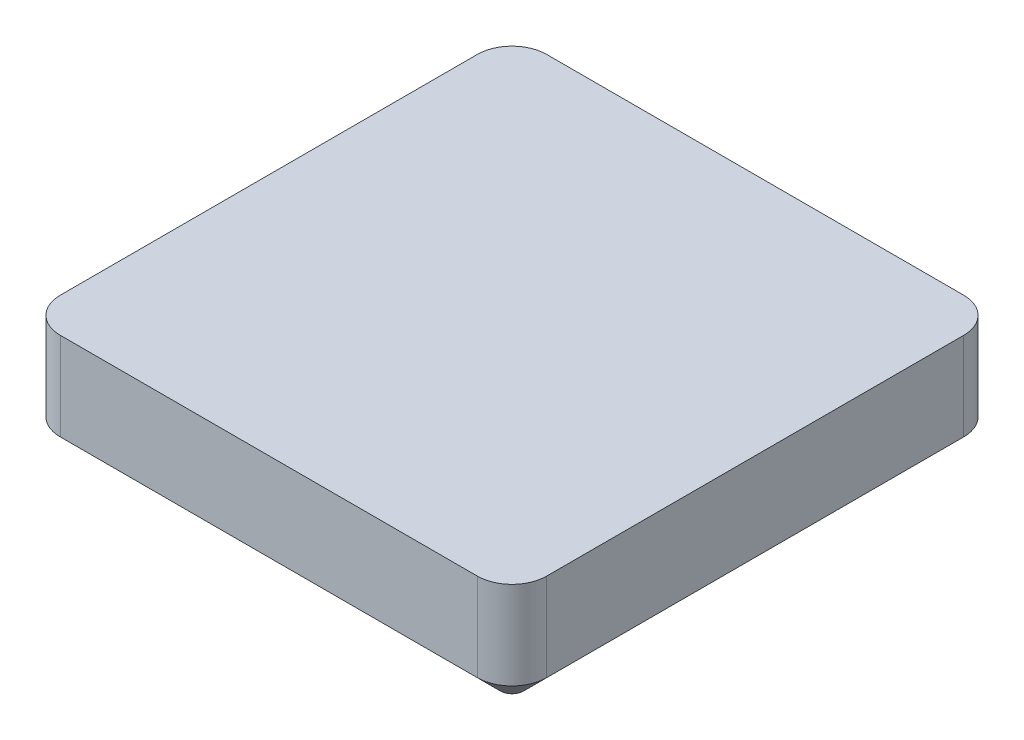
from build123d import *

# Parameters (mm, degrees)
SKETCH_1_W      = 210
SKETCH_1_H      = 210
EXTRUDE_1_DEPTH = 48
FILLET_1_R      = 15
CHAMFER_1_SIZE  = 10


with BuildPart() as part:
    # 草图1 → 凸台-拉伸1 (new body)
    with BuildSketch(Plane(origin=(0, 0, 0), x_dir=(1, 0, 0), z_dir=(0, 1, 0))):
        with Locations((105, -105)):
            Rectangle(SKETCH_1_W, SKETCH_1_H)
    extrude(amount=EXTRUDE_1_DEPTH)

    # 圆角1
    fillet_1_edges = [part.edges().sort_by_distance(p)[0] for p in [
        (0, 24, 0),
        (210, 24, 0),
        (210, 24, 210),
        (0, 24, 210),
    ]]
    fillet(fillet_1_edges, radius=FILLET_1_R)

    # 倒角1
    chamfer_1_edges = [part.edges().sort_by_distance(p)[0] for p in [
        (0, 0, 105),
        (105, 0, 0),
        (210, 0, 105),
        (105, 0, 210),
        (4.393398282, 0, 205.606601718),
        (205.606601718, 0, 205.606601718),
        (205.606601718, 0, 4.393398282),
        (4.393398282, 0, 4.393398282),
    ]]
    chamfer(chamfer_1_edges, length=CHAMFER_1_SIZE)


solid = part.part
